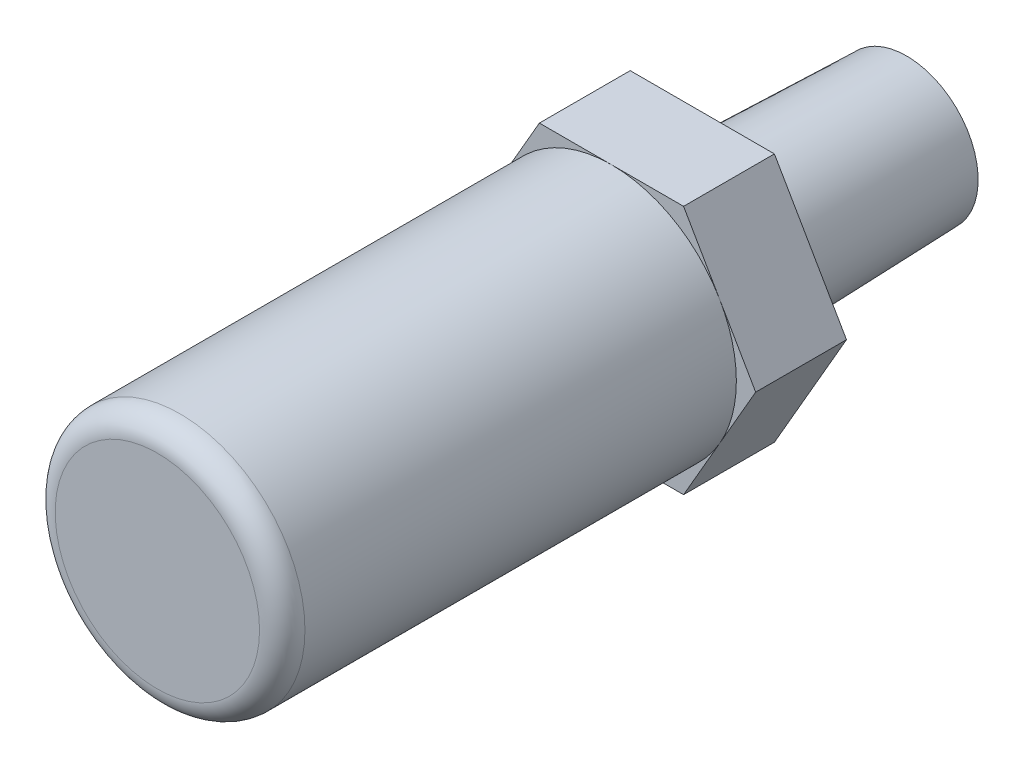
from build123d import *

# Parameters (mm, degrees)
SKETCH1_R           = 11
BOSS_EXTRUDE1_DEPTH = 40
BOSS_EXTRUDE2_DEPTH = 8
FILLET1_R           = 2


with BuildPart() as part:
    # Sketch1 → Boss-Extrude1 (new body)
    with BuildSketch(Plane.XY):
        Circle(SKETCH1_R)
    extrude(amount=-BOSS_EXTRUDE1_DEPTH)

    # Sketch2 → Boss-Extrude2 (add)
    with BuildSketch(Plane(origin=(0, 0, -40), x_dir=(-1, 0, 0), z_dir=(0, 0, -1))):
        Polygon((6.350852961, 11), (-6.350852961, 11), (-12.701705922, 0), (-6.350852961, -11), (6.350852961, -11), (12.701705922, 0), align=None)
    extrude(amount=BOSS_EXTRUDE2_DEPTH)

    # Sketch6 → Revolve1 (revolve)
    with BuildSketch(Plane(origin=(0, 0, 0), x_dir=(0, 0, -1), z_dir=(1, 0, 0)), mode=Mode.PRIVATE) as revolve1_sk:
        Polygon((48, 6.86), (66, 6.297503336), (66, 2), (48, 2), align=None)
    revolve(revolve1_sk.sketch.rotate(Axis((0, 0, 0), (0, 0, 1)), 90), axis=Axis((0, 0, 0), (0, 0, 1)))

    # Fillet1
    fillet1_edges = [part.edges().sort_by_distance(p)[0] for p in [
        (-11, 0, 0),
    ]]
    fillet(fillet1_edges, radius=FILLET1_R)


solid = part.part
